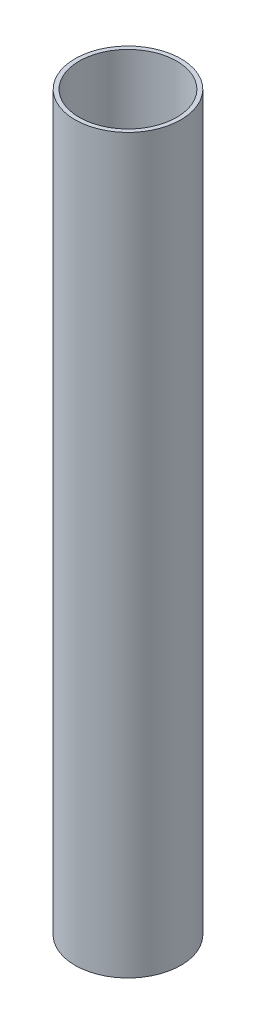
from build123d import *

# Parameters (mm, degrees)
SKETCH1_R           = 15.9
SKETCH1_R_2         = 14.65
BOSS_EXTRUDE1_DEPTH = 220


with BuildPart() as part:
    # Sketch1 → Boss-Extrude1 (new body)
    with BuildSketch(Plane(origin=(0, 0, 0), x_dir=(1, 0, 0), z_dir=(0, 1, 0))):
        with Locations(Location((0, 0, 0), (0, 0, 270))):
            Circle(SKETCH1_R)
        with Locations(Location((0, 0, 0), (0, 0, 270))):
            Circle(SKETCH1_R_2, mode=Mode.SUBTRACT)
    extrude(amount=BOSS_EXTRUDE1_DEPTH)


solid = part.part
